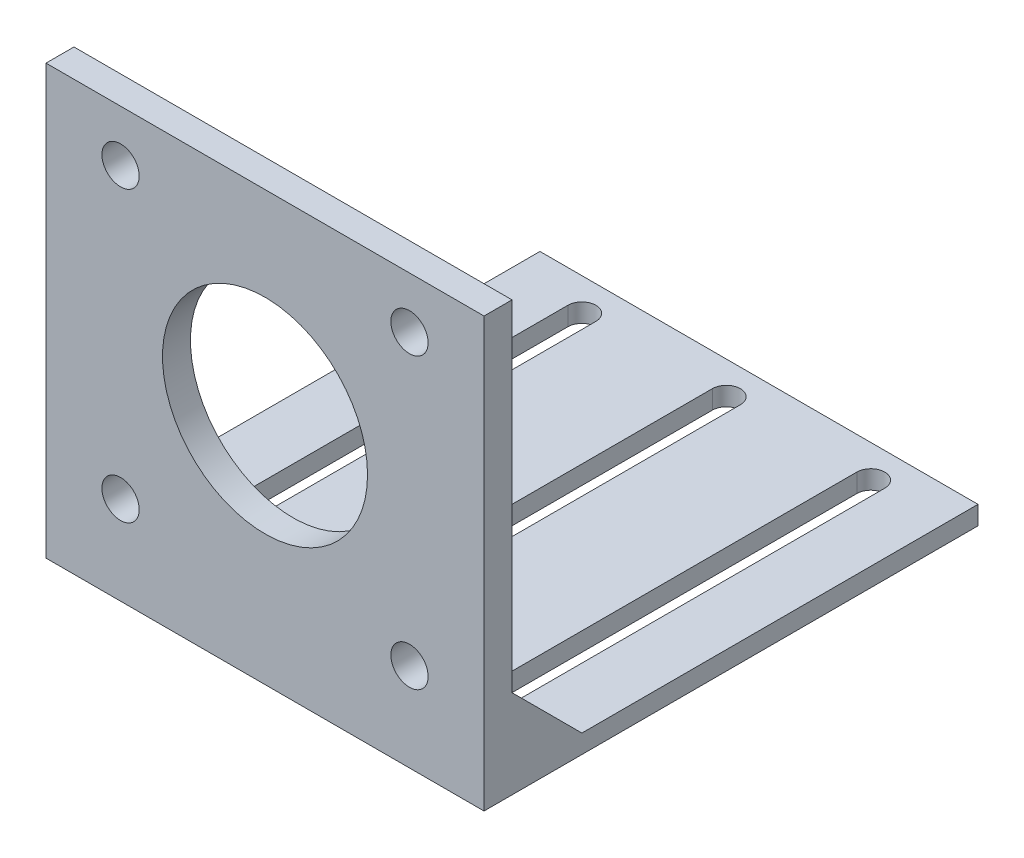
from build123d import *

# Parameters (mm, degrees)
SKETCH2_W           = 47
SKETCH2_H           = 42
SKETCH2_R           = 2
SKETCH2_R_2         = 11
BOSS_EXTRUDE1_DEPTH = 3
SKETCH2_3_W         = 47
SKETCH2_3_H         = 4
BOSS_EXTRUDE2_DEPTH = 3
SKETCH3_W           = 47
SKETCH3_H           = 2
BOSS_EXTRUDE3_DEPTH = 50
RIB1_REACH          = 84.353
SKETCH8_WALL_W      = 177.312400038
SKETCH8_WALL_H      = 2
RIB2_REACH          = 84.353
SKETCH10_WALL_W     = 177.312400038
SKETCH10_WALL_H     = 2
CUT_EXTRUDE1_DEPTH  = 50


with BuildPart() as part:
    # Sketch2 → Boss-Extrude1 (new body)
    with BuildSketch(Plane.XY):
        with Locations((23.5, 21)):
            Rectangle(SKETCH2_W, SKETCH2_H)
        with Locations((39, 5.5)):
            Circle(SKETCH2_R, mode=Mode.SUBTRACT)
        with Locations((8, 5.5)):
            Circle(SKETCH2_R, mode=Mode.SUBTRACT)
        with Locations((23.5, 21)):
            Circle(SKETCH2_R_2, mode=Mode.SUBTRACT)
        with Locations((39, 36.5)):
            Circle(SKETCH2_R, mode=Mode.SUBTRACT)
        with Locations((8, 36.5)):
            Circle(SKETCH2_R, mode=Mode.SUBTRACT)
    extrude(amount=-BOSS_EXTRUDE1_DEPTH)

    # Sketch2<3> → Boss-Extrude2 (add)
    with BuildSketch(Plane.XY):
        with Locations((23.5, -2)):
            Rectangle(SKETCH2_3_W, SKETCH2_3_H)
    extrude(amount=-BOSS_EXTRUDE2_DEPTH)

    # Sketch3 → Boss-Extrude3 (add)
    with BuildSketch(Plane(origin=(0, 0, -3), x_dir=(-1, 0, 0), z_dir=(0, 0, -1))):
        with Locations((-23.5, -3)):
            Rectangle(SKETCH3_W, SKETCH3_H)
    extrude(amount=BOSS_EXTRUDE3_DEPTH)

    # Sketch8 wall → Rib1 (add, up to next)
    with BuildSketch(Plane(origin=(0, 1.75, -6.75), x_dir=(0, -0.707106781187, -0.707106781187), z_dir=(0, 0.707106781187, -0.707106781187)), mode=Mode.PRIVATE) as rib1_sk1:
        with Locations((0, -1)):
            Rectangle(SKETCH8_WALL_W, SKETCH8_WALL_H)
    rib1_tool1 = extrude(rib1_sk1.sketch, amount=-RIB1_REACH, mode=Mode.PRIVATE) - part.part
    add(rib1_tool1.solids().sort_by_distance((0, 1.75, -6.75))[0])

    # Sketch10 wall → Rib2 (add, up to next)
    with BuildSketch(Plane(origin=(47, 1.75, -6.75), x_dir=(0, -0.707106781187, -0.707106781187), z_dir=(0, 0.707106781187, -0.707106781187)), mode=Mode.PRIVATE) as rib2_sk1:
        with Locations((0, 1)):
            Rectangle(SKETCH10_WALL_W, SKETCH10_WALL_H)
    rib2_tool1 = extrude(rib2_sk1.sketch, amount=-RIB2_REACH, mode=Mode.PRIVATE) - part.part
    add(rib2_tool1.solids().sort_by_distance((47, 1.75, -6.75))[0])

    # Sketch11 → Cut-Extrude1 (cut)
    with BuildSketch(Plane(origin=(0, -2, 0), x_dir=(1, 0, 0), z_dir=(0, 1, 0))):
        with BuildLine():
            Line((9.5, 49.5), (9.5, 10.5))
            ThreePointArc((9.5, 10.5), (8, 9), (6.5, 10.5))
            Line((6.5, 10.5), (6.5, 49.5))
            ThreePointArc((6.5, 49.5), (8, 51), (9.5, 49.5))
        make_face()
        with BuildLine():
            Line((22, 10.5), (22, 49.5))
            ThreePointArc((22, 49.5), (23.5, 51), (25, 49.5))
            Line((25, 49.5), (25, 10.5))
            ThreePointArc((25, 10.5), (23.5, 9), (22, 10.5))
        make_face()
        with BuildLine():
            Line((40.5, 49.5), (40.5, 10.5))
            ThreePointArc((40.5, 10.5), (39, 9), (37.5, 10.5))
            Line((37.5, 10.5), (37.5, 49.5))
            ThreePointArc((37.5, 49.5), (39, 51), (40.5, 49.5))
        make_face()
    extrude(amount=-CUT_EXTRUDE1_DEPTH, mode=Mode.SUBTRACT)


solid = part.part
